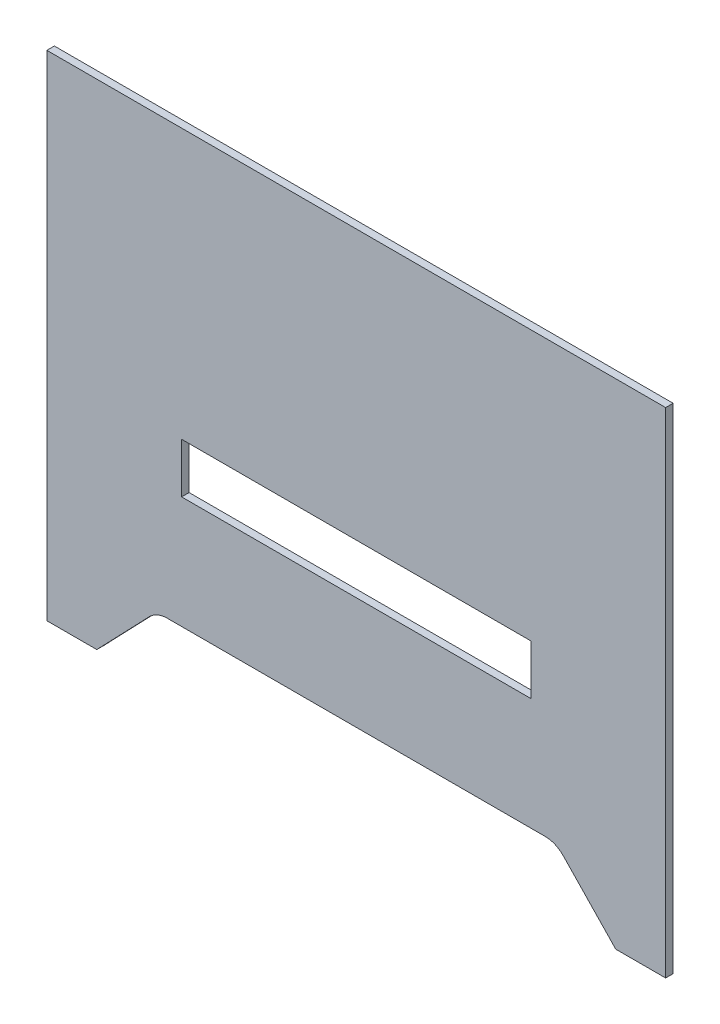
from build123d import *

# Parameters (mm, degrees)
SKETCH1_W           = 140
SKETCH1_H           = 20
BOSS_EXTRUDE1_DEPTH = 3


with BuildPart() as part:
    # Sketch1 → Boss-Extrude1 (new body)
    with BuildSketch(Plane.XY):
        with BuildLine():
            Line((-124, -99), (-124, 99))
            Line((-124, 99), (124, 99))
            Line((124, 99), (124, -99))
            Line((124, -99), (104, -99))
            Line((104, -99), (82.951694449, -77.074681718))
            ThreePointArc((82.951694449, -77.074681718), (79.65871509, -74.800728757), (75.737821239, -74))
            Line((75.737821239, -74), (-75.737821239, -74))
            ThreePointArc((-75.737821239, -74), (-79.65871509, -74.800728757), (-82.951694449, -77.074681718))
            Line((-82.951694449, -77.074681718), (-104, -99))
            Line((-104, -99), (-124, -99))
        make_face()
        with Locations((0, -19)):
            Rectangle(SKETCH1_W, SKETCH1_H, mode=Mode.SUBTRACT)
    extrude(amount=BOSS_EXTRUDE1_DEPTH)


solid = part.part
